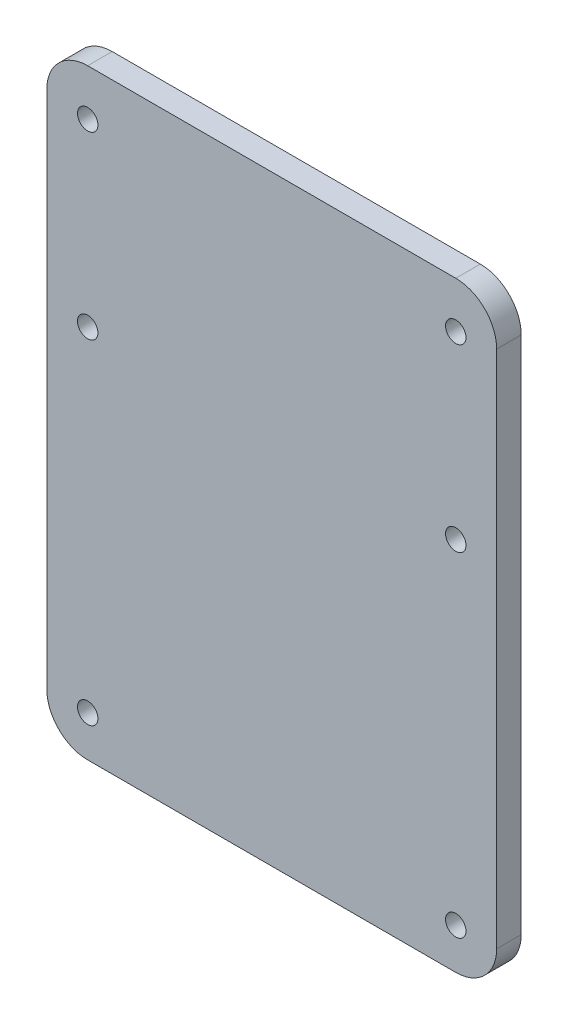
from build123d import *

# Parameters (mm, degrees)
SKETCH1_W           = 55
SKETCH1_H           = 73.5
BOSS_EXTRUDE1_DEPTH = 3
SKETCH2_R           = 1.25
CUT_EXTRUDE1_DEPTH  = 3
FILLET1_R           = 5


with BuildPart() as part:
    # Sketch1 → Boss-Extrude1 (new body)
    with BuildSketch(Plane.XY):
        with Locations((1.762820513, 5.498931624)):
            Rectangle(SKETCH1_W, SKETCH1_H)
    extrude(amount=BOSS_EXTRUDE1_DEPTH)

    # Sketch2 → Cut-Extrude1 (cut)
    with BuildSketch(Plane.XY.offset(3)):
        with Locations((-20.737179487, 36.587967336)):
            Circle(SKETCH2_R)
        with Locations((24.262820513, 36.587967336)):
            Circle(SKETCH2_R)
        with Locations((-20.737179487, 14.587967336)):
            Circle(SKETCH2_R)
        with Locations((24.262820513, 14.587967336)):
            Circle(SKETCH2_R)
        with Locations((-20.737179487, -26.251068376)):
            Circle(SKETCH2_R)
        with Locations((24.262820513, -26.251068376)):
            Circle(SKETCH2_R)
    extrude(amount=-CUT_EXTRUDE1_DEPTH, mode=Mode.SUBTRACT)

    # Fillet1
    fillet1_edges = [part.edges().sort_by_distance(p)[0] for p in [
        (-25.737179487, 42.248931624, 1.5),
        (29.262820513, 42.248931624, 1.5),
        (29.262820513, -31.251068376, 1.5),
        (-25.737179487, -31.251068376, 1.5),
    ]]
    fillet(fillet1_edges, radius=FILLET1_R)


solid = part.part
